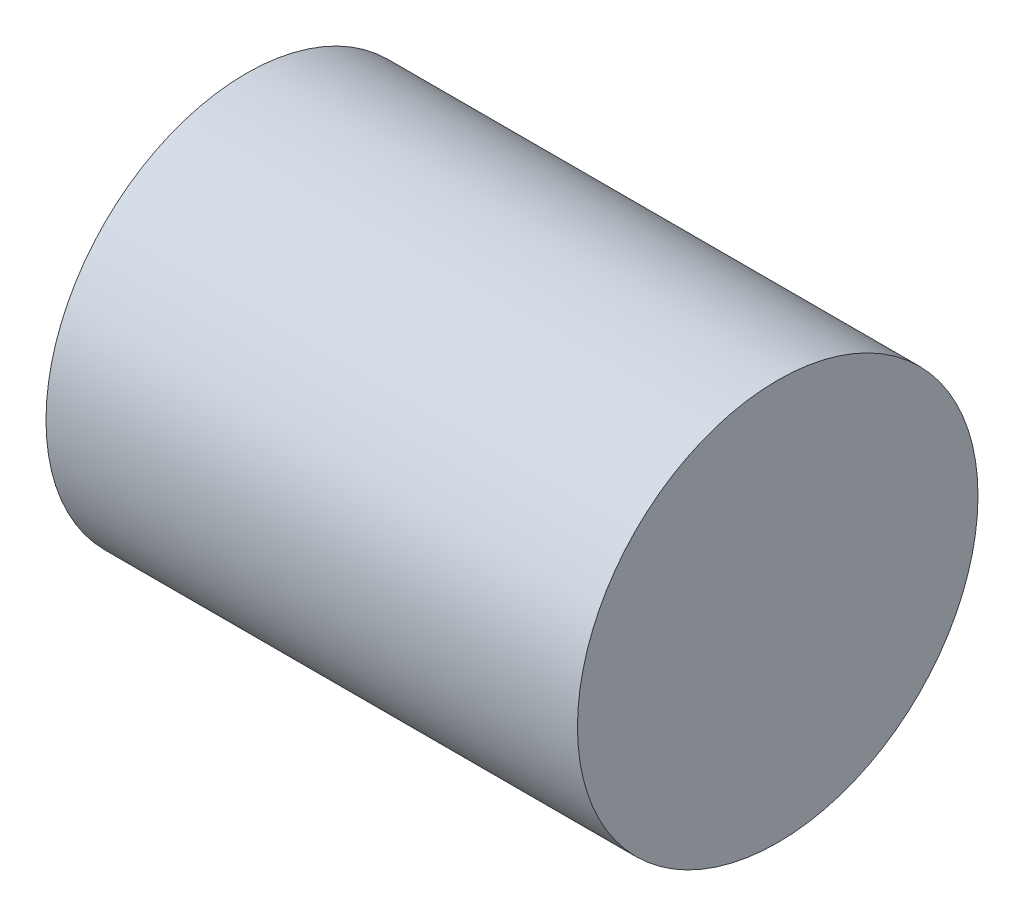
from build123d import *

# Parameters (mm, degrees)
CURVESKETCH_R   = 8.719
CURVEBOSS_DEPTH = 23.137


with BuildPart() as part:
    # CurveSketch → CurveBoss (new body)
    with BuildSketch(Plane(origin=(0, 0, 0), x_dir=(0, 0, -1), z_dir=(1, 0, 0))):
        with Locations((9.173, -2.419)):
            Circle(CURVESKETCH_R)
    extrude(amount=-CURVEBOSS_DEPTH)


solid = part.part
